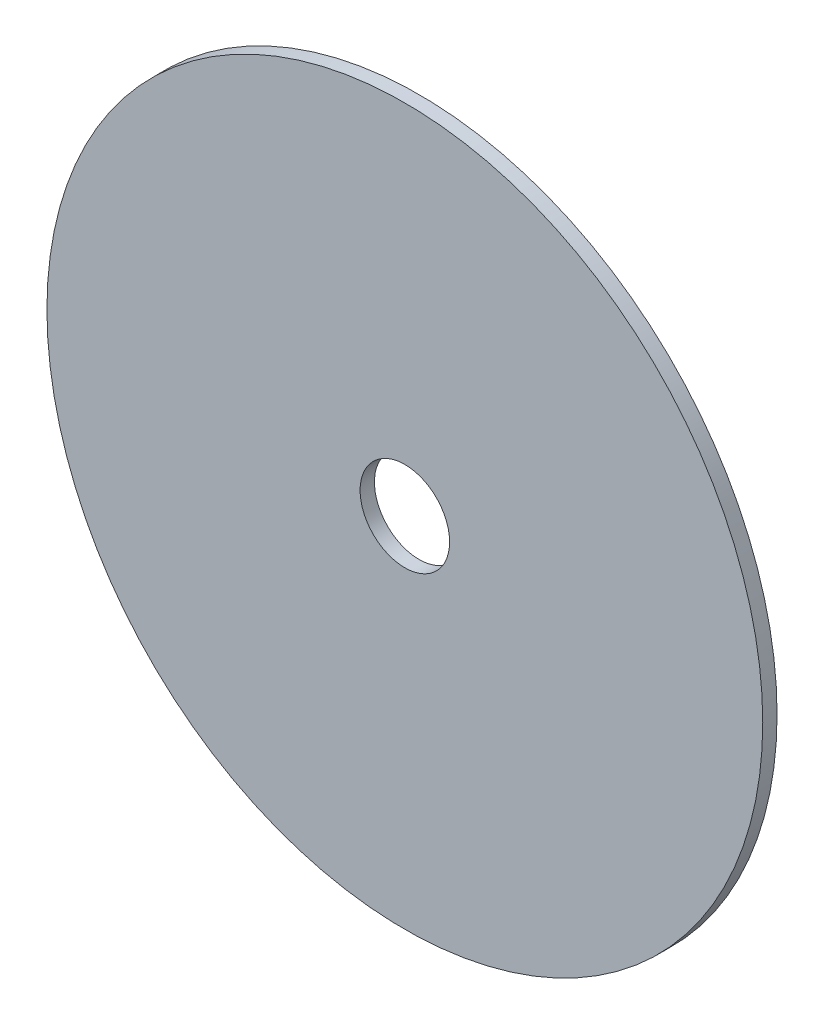
from build123d import *

# Parameters (mm, degrees)
ESQUISSE1_R        = 40
ESQUISSE1_R_2      = 5
BOSS_EXTRU_1_DEPTH = 1.6


with BuildPart() as part:
    # Esquisse1 → Boss.-Extru.1 (new body)
    with BuildSketch(Plane.XY):
        Circle(ESQUISSE1_R)
        Circle(ESQUISSE1_R_2, mode=Mode.SUBTRACT)
    extrude(amount=BOSS_EXTRU_1_DEPTH)


solid = part.part
